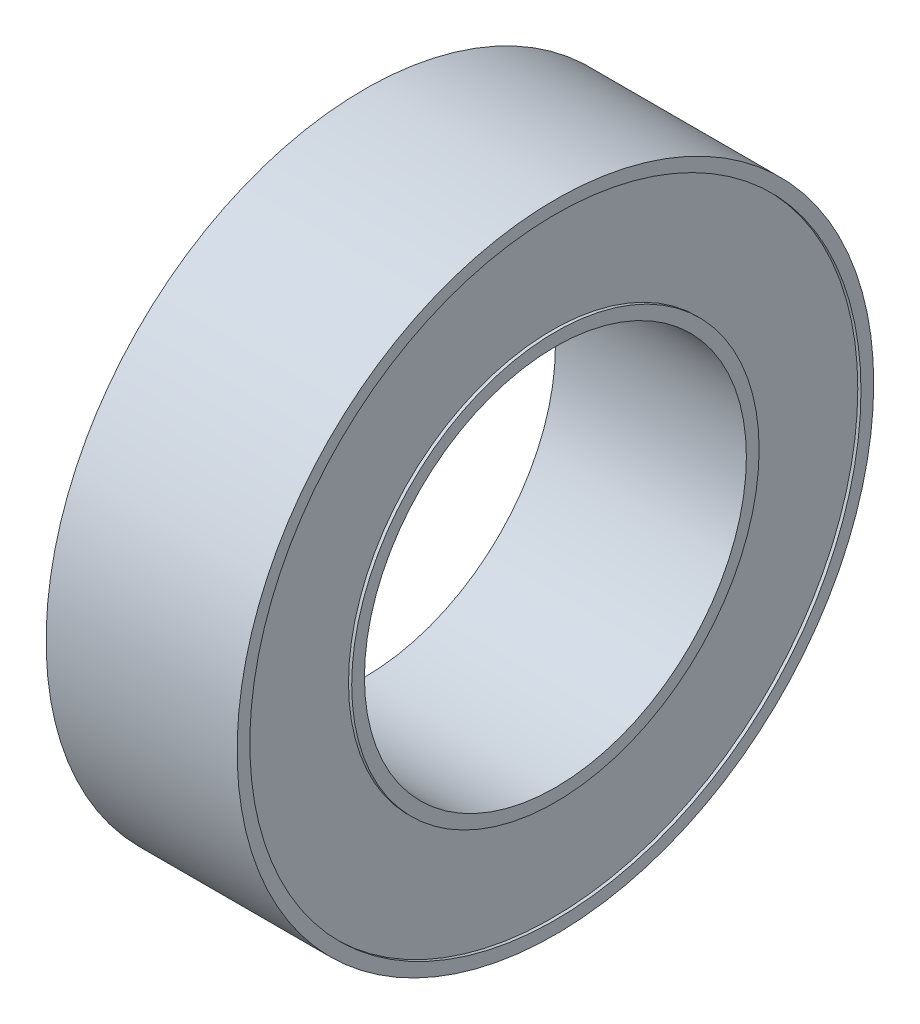
from build123d import *

# Parameters (mm, degrees)
SKETCH1_R           = 5
SKETCH1_R_2         = 3
BOSS_EXTRUDE1_DEPTH = 1.5
SKETCH2_R           = 4.8
SKETCH2_R_2         = 3.2
CUT_EXTRUDE1_DEPTH  = 0.05


with BuildPart() as part:
    # Sketch1 → Boss-Extrude1 (new, symmetric)
    with BuildSketch(Plane(origin=(0, 0, 0), x_dir=(0, 0, -1), z_dir=(1, 0, 0))):
        Circle(SKETCH1_R)
        Circle(SKETCH1_R_2, mode=Mode.SUBTRACT)
    extrude(amount=BOSS_EXTRUDE1_DEPTH, both=True)

    # Sketch2 → Cut-Extrude1 (cut)
    with BuildSketch(Plane(origin=(1.5, 0, 0), x_dir=(0, 0, -1), z_dir=(1, 0, 0))):
        Circle(SKETCH2_R)
        Circle(SKETCH2_R_2, mode=Mode.SUBTRACT)
    cut_extrude1 = extrude(amount=-CUT_EXTRUDE1_DEPTH, mode=Mode.SUBTRACT)

    # Mirror1: Cut-Extrude1 across plane
    add(cut_extrude1.mirror(Plane(origin=(0, 0, 0), x_dir=(0, 0, 1), z_dir=(1, 0, 0))), mode=Mode.SUBTRACT)


solid = part.part
